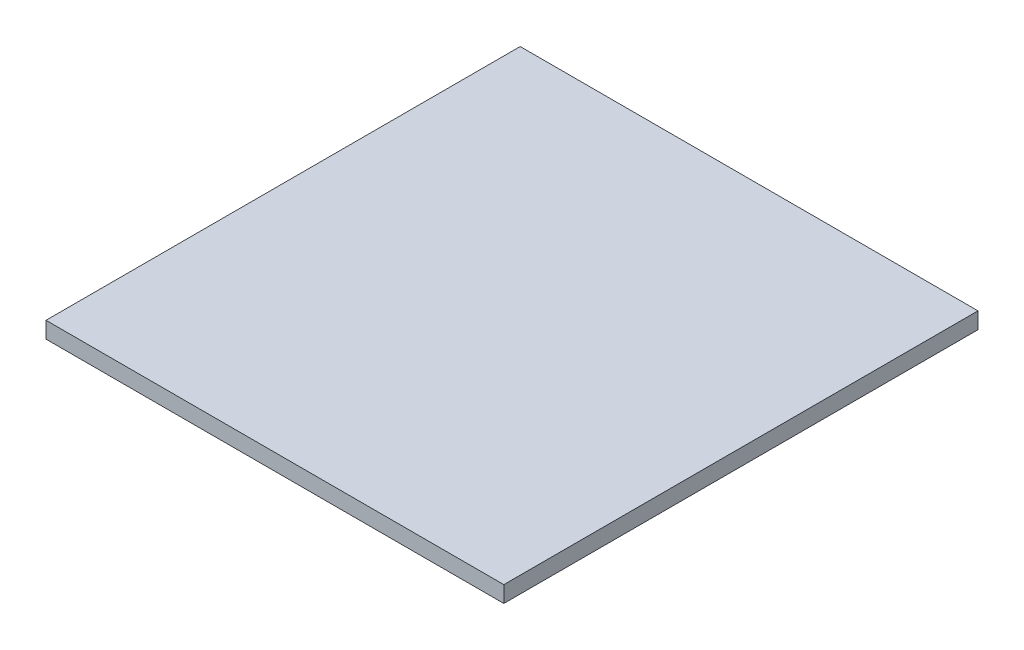
from build123d import *

# Parameters (mm, degrees)
SKETCH1_W           = 280
SKETCH1_H           = 10
BOSS_EXTRUDE1_DEPTH = 290


with BuildPart() as part:
    # Sketch1 → Boss-Extrude1 (new body)
    with BuildSketch(Plane.XY):
        with Locations((140, -5)):
            Rectangle(SKETCH1_W, SKETCH1_H)
    extrude(amount=BOSS_EXTRUDE1_DEPTH)


solid = part.part
